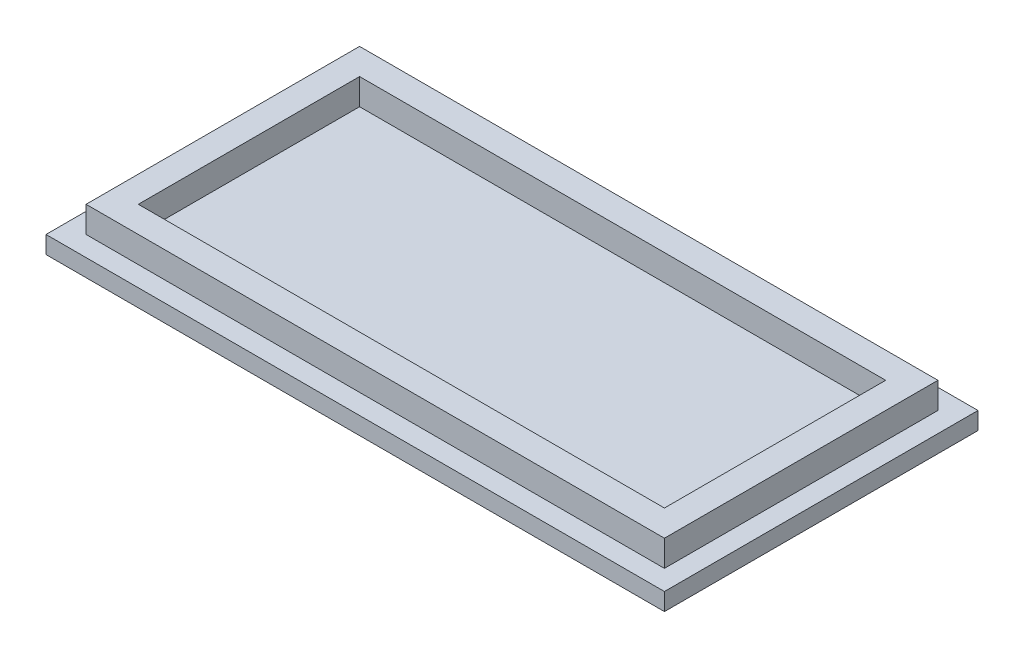
from build123d import *

# Parameters (mm, degrees)
SCHIZZO1_W                   = 71
SCHIZZO1_H                   = 36
ESTRUSIONE_ESTRUSIONE1_DEPTH = 2
SCHIZZO2_W                   = 66.4
SCHIZZO2_H                   = 31.4
ESTRUSIONE_ESTRUSIONE2_DEPTH = 3
SCHIZZO3_R                   = 5
ESTRUSIONE_ESTRUSIONE3_DEPTH = 5
SCHIZZO4_W                   = 60.4
SCHIZZO4_H                   = 25.4
TAGLIO_ESTRUSIONE1_DEPTH     = 3


with BuildPart() as part:
    # Schizzo1 → Estrusione-Estrusione1 (new body)
    with BuildSketch(Plane(origin=(0, 0, 0), x_dir=(1, 0, 0), z_dir=(0, 1, 0))):
        Rectangle(SCHIZZO1_W, SCHIZZO1_H)
    extrude(amount=ESTRUSIONE_ESTRUSIONE1_DEPTH)

    # Schizzo2 → Estrusione-Estrusione2 (add)
    with BuildSketch(Plane(origin=(0, 2, 0), x_dir=(1, 0, 0), z_dir=(0, 1, 0))):
        Rectangle(SCHIZZO2_W, SCHIZZO2_H)
    extrude(amount=ESTRUSIONE_ESTRUSIONE2_DEPTH)

    # Schizzo3 → Estrusione-Estrusione3 (add)
    with BuildSketch(Plane.XZ):
        with Locations(Location((0, 0, 0), (0, 0, 270))):
            Circle(SCHIZZO3_R)
    extrude(amount=ESTRUSIONE_ESTRUSIONE3_DEPTH)

    # Schizzo4 → Taglio-Estrusione1 (cut)
    with BuildSketch(Plane(origin=(0, 5, 0), x_dir=(1, 0, 0), z_dir=(0, 1, 0))):
        Rectangle(SCHIZZO4_W, SCHIZZO4_H)
    extrude(amount=-TAGLIO_ESTRUSIONE1_DEPTH, mode=Mode.SUBTRACT)


solid = part.part
